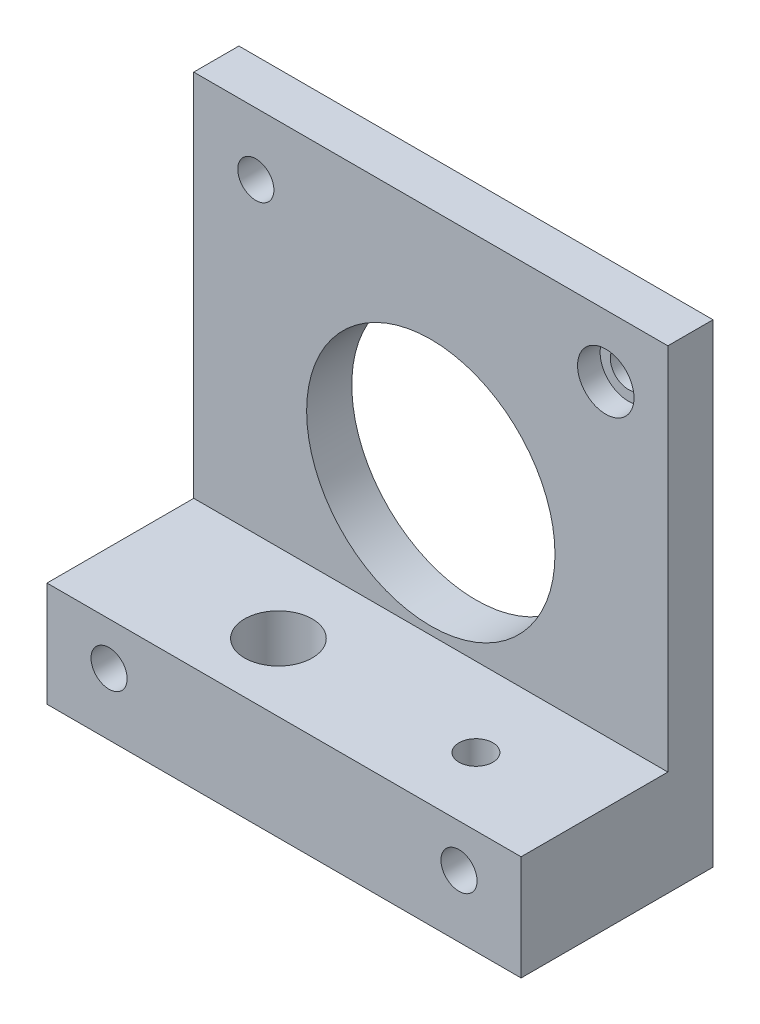
from build123d import *

# Parameters (mm, degrees)
SKETCH1_W               = 42
SKETCH1_H               = 42
BOSS_EXTRUDE1_DEPTH     = 17
SKETCH3_W               = 42
SKETCH3_H               = 13
CUT_EXTRUDE1_DEPTH      = 32.7
CUT_EXTRUDE2_DEPTH      = 61.802960454
CUT_EXTRUDE2_DEPTH_BACK = 61.802960454
SKETCH4_R               = 1.6
SKETCH4_R_2             = 11
SKETCH5_R               = 2.5
CUT_EXTRUDE3_DEPTH      = 2
SKETCH6_R               = 1.5
SKETCH6_R_2             = 3
CUT_EXTRUDE4_DEPTH      = 56.877455203


with BuildPart() as part:
    # Sketch1 → Boss-Extrude1 (new body)
    with BuildSketch(Plane.XY):
        with Locations((21, 21)):
            Rectangle(SKETCH1_W, SKETCH1_H)
    extrude(amount=BOSS_EXTRUDE1_DEPTH)

    # Sketch3 → Cut-Extrude1 (cut)
    with BuildSketch(Plane(origin=(0, 42, 0), x_dir=(1, 0, 0), z_dir=(0, 1, 0))):
        with Locations((21, -10.5)):
            Rectangle(SKETCH3_W, SKETCH3_H)
    extrude(amount=-CUT_EXTRUDE1_DEPTH, mode=Mode.SUBTRACT)

    # Sketch4 → Cut-Extrude2 (cut, two sides: drawn at the far end of the back side and taken through both)
    with BuildSketch(Plane.XY.offset(4).offset(-CUT_EXTRUDE2_DEPTH_BACK)):
        with Locations((36.5, 36.5)):
            Circle(SKETCH4_R)
        with Locations((5.5, 36.5)):
            Circle(SKETCH4_R)
        with Locations((21, 21)):
            Circle(SKETCH4_R_2)
        with Locations((5.5, 5.5)):
            Circle(SKETCH4_R)
        with Locations((36.5, 5.5)):
            Circle(SKETCH4_R)
    extrude(amount=CUT_EXTRUDE2_DEPTH + CUT_EXTRUDE2_DEPTH_BACK, mode=Mode.SUBTRACT)

    # Sketch5 → Cut-Extrude3 (cut)
    with BuildSketch(Plane.XY.offset(4)):
        with Locations((36.5, 36.5)):
            Circle(SKETCH5_R)
    extrude(amount=-CUT_EXTRUDE3_DEPTH, mode=Mode.SUBTRACT)

    # Sketch6 → Cut-Extrude4 (cut, through all)
    with BuildSketch(Plane(origin=(0, 9.3, 0), x_dir=(1, 0, 0), z_dir=(0, 1, 0))):
        with Locations(Location((32, -11, 0), (0, 0, 270))):
            Circle(SKETCH6_R)
        with Locations(Location((14.5, -11, 0), (0, 0, 270))):
            Circle(SKETCH6_R_2)
    extrude(amount=-CUT_EXTRUDE4_DEPTH, mode=Mode.SUBTRACT)


solid = part.part
